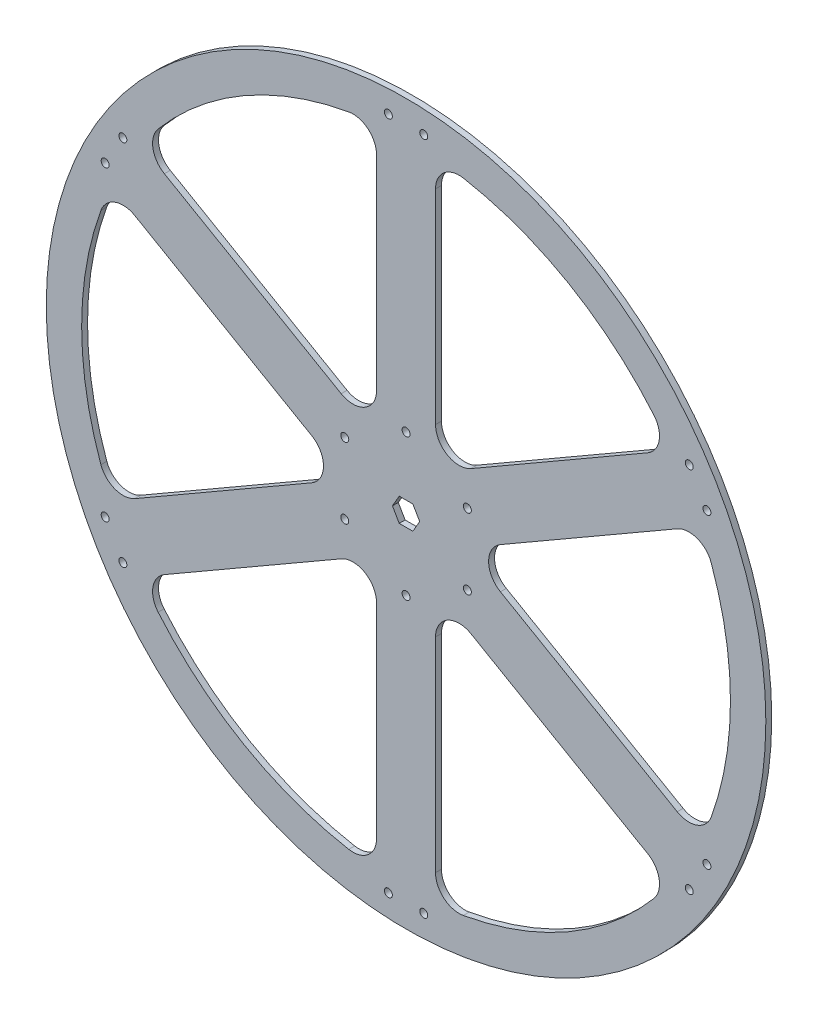
from build123d import *

# Parameters (mm, degrees)
SKETCH1_R             = 193.675
SKETCH1_R_2           = 174.625
BOSS_EXTRUDE1_DEPTH   = 3.175
SKETCH1_R_3           = 33.3375
BOSS_EXTRUDE1_2_DEPTH = 3.175
BOSS_EXTRUDE2_START   = -3.175
BOSS_EXTRUDE2_DEPTH   = 3.175
SKETCH3_R             = 2.15265
CUT_EXTRUDE1_DEPTH    = 3.175
SKETCH4_R             = 2.15265
CUT_EXTRUDE2_DEPTH    = 3.175
CIRPATTERN1_COUNT     = 6


with BuildPart() as part:
    # Sketch1 → Boss-Extrude1 (new body)
    with BuildSketch(Plane.XY):
        Circle(SKETCH1_R)
        Circle(SKETCH1_R_2, mode=Mode.SUBTRACT)
    extrude(amount=BOSS_EXTRUDE1_DEPTH)



with BuildPart() as body_2:
    # Sketch1 → Boss-Extrude1 2 (new body)
    with BuildSketch(Plane.XY):
        Circle(SKETCH1_R_3)
        Polygon((7.332348419, 0), (3.666174209, 6.35), (-3.666174209, 6.35), (-7.332348419, 0), (-3.666174209, -6.35), (3.666174209, -6.35), align=None, mode=Mode.SUBTRACT)
    extrude(amount=BOSS_EXTRUDE1_2_DEPTH)


with BuildPart() as part_1:
    add(part.part)

    add(body_2.part)  # Boss-Extrude2 merges body 2
    # Sketch2 → Boss-Extrude2 (add)
    with BuildSketch(Plane.XY.offset(3.175).offset(BOSS_EXTRUDE2_START)):
        with BuildLine():
            Line((15.875, 49.493351826), (15.875, 159.383735055))
            ThreePointArc((15.875, 159.383735055), (20.425550361, 169.124190413), (30.816176471, 171.884420157))
            ThreePointArc((30.816176471, 171.884420157), (0, 174.625), (-30.816176471, 171.884420157))
            ThreePointArc((-30.816176471, 171.884420157), (-20.425550361, 169.124190413), (-15.875, 159.383735055))
            Line((-15.875, 159.383735055), (-15.875, 49.493351826))
            ThreePointArc((-15.875, 49.493351826), (-22.225, 38.494829198), (-34.925, 38.494829198))
            Line((-34.925, 38.494829198), (-130.092863507, 93.440020812))
            ThreePointArc((-130.092863507, 93.440020812), (-136.253070112, 102.251140706), (-133.448186135, 112.62980175))
            ThreePointArc((-133.448186135, 112.62980175), (-151.229686136, 87.3125), (-164.264362606, 59.254618408))
            ThreePointArc((-164.264362606, 59.254618408), (-156.678620473, 66.873049707), (-145.967863507, 65.943714242))
            Line((-145.967863507, 65.943714242), (-50.8, 10.998522628))
            ThreePointArc((-50.8, 10.998522628), (-44.45, 0), (-50.8, -10.998522628))
            Line((-50.8, -10.998522628), (-145.967863507, -65.943714242))
            ThreePointArc((-145.967863507, -65.943714242), (-156.678620473, -66.873049707), (-164.264362606, -59.254618408))
            ThreePointArc((-164.264362606, -59.254618408), (-151.229686136, -87.3125), (-133.448186135, -112.62980175))
            ThreePointArc((-133.448186135, -112.62980175), (-136.253070112, -102.251140706), (-130.092863507, -93.440020812))
            Line((-130.092863507, -93.440020812), (-34.925, -38.494829198))
            ThreePointArc((-34.925, -38.494829198), (-22.225, -38.494829198), (-15.875, -49.493351826))
            Line((-15.875, -49.493351826), (-15.875, -159.383735055))
            ThreePointArc((-15.875, -159.383735055), (-20.425550361, -169.124190413), (-30.816176471, -171.884420157))
            ThreePointArc((-30.816176471, -171.884420157), (0, -174.625), (30.816176471, -171.884420157))
            ThreePointArc((30.816176471, -171.884420157), (20.425550361, -169.124190413), (15.875, -159.383735055))
            Line((15.875, -159.383735055), (15.875, -49.493351826))
            ThreePointArc((15.875, -49.493351826), (22.225, -38.494829198), (34.925, -38.494829198))
            Line((34.925, -38.494829198), (130.092863507, -93.440020812))
            ThreePointArc((130.092863507, -93.440020812), (136.253070112, -102.251140706), (133.448186135, -112.62980175))
            ThreePointArc((133.448186135, -112.62980175), (151.229686136, -87.3125), (164.264362606, -59.254618408))
            ThreePointArc((164.264362606, -59.254618408), (156.678620473, -66.873049707), (145.967863507, -65.943714242))
            Line((145.967863507, -65.943714242), (50.8, -10.998522628))
            ThreePointArc((50.8, -10.998522628), (44.45, 0), (50.8, 10.998522628))
            Line((50.8, 10.998522628), (145.967863507, 65.943714242))
            ThreePointArc((145.967863507, 65.943714242), (156.678620473, 66.873049707), (164.264362606, 59.254618408))
            ThreePointArc((164.264362606, 59.254618408), (151.229686136, 87.3125), (133.448186135, 112.62980175))
            ThreePointArc((133.448186135, 112.62980175), (136.253070112, 102.251140706), (130.092863507, 93.440020812))
            Line((130.092863507, 93.440020812), (34.925, 38.494829198))
            ThreePointArc((34.925, 38.494829198), (22.225, 38.494829198), (15.875, 49.493351826))
        make_face()
        Polygon((7.332348419, 0), (3.666174209, 6.35), (-3.666174209, 6.35), (-7.332348419, 0), (-3.666174209, -6.35), (3.666174209, -6.35), align=None, mode=Mode.SUBTRACT)
    extrude(amount=BOSS_EXTRUDE2_DEPTH)

    # Sketch3 → Cut-Extrude1 (cut)
    with BuildSketch(Plane.XY.offset(3.175)):
        with Locations((0, 38.1)):
            Circle(SKETCH3_R)
        with Locations((32.995567884, 19.05)):
            Circle(SKETCH3_R)
        with Locations((32.995567884, -19.05)):
            Circle(SKETCH3_R)
        with Locations((0, -38.1)):
            Circle(SKETCH3_R)
        with Locations((-32.995567884, -19.05)):
            Circle(SKETCH3_R)
        with Locations((-32.995567884, 19.05)):
            Circle(SKETCH3_R)
    extrude(amount=-CUT_EXTRUDE1_DEPTH, mode=Mode.SUBTRACT)

    # Sketch4 → Cut-Extrude2 (cut)
    with BuildSketch(Plane.XY.offset(3.175)):
        with Locations((-9.520641414, 181.519243783)):
            Circle(SKETCH4_R)
        with Locations((9.520641414, 181.519243783)):
            Circle(SKETCH4_R)
    cut_extrude2 = extrude(amount=-CUT_EXTRUDE2_DEPTH, mode=Mode.SUBTRACT)

    # CirPattern1: Cut-Extrude2 ×6 about axis
    cirpattern1_axis = Axis((0, 0, 0), (0, 0, 1))
    for i in range(1, CIRPATTERN1_COUNT):
        add(cut_extrude2.rotate(cirpattern1_axis, i * 360 / CIRPATTERN1_COUNT), mode=Mode.SUBTRACT)


solid = part_1.part
